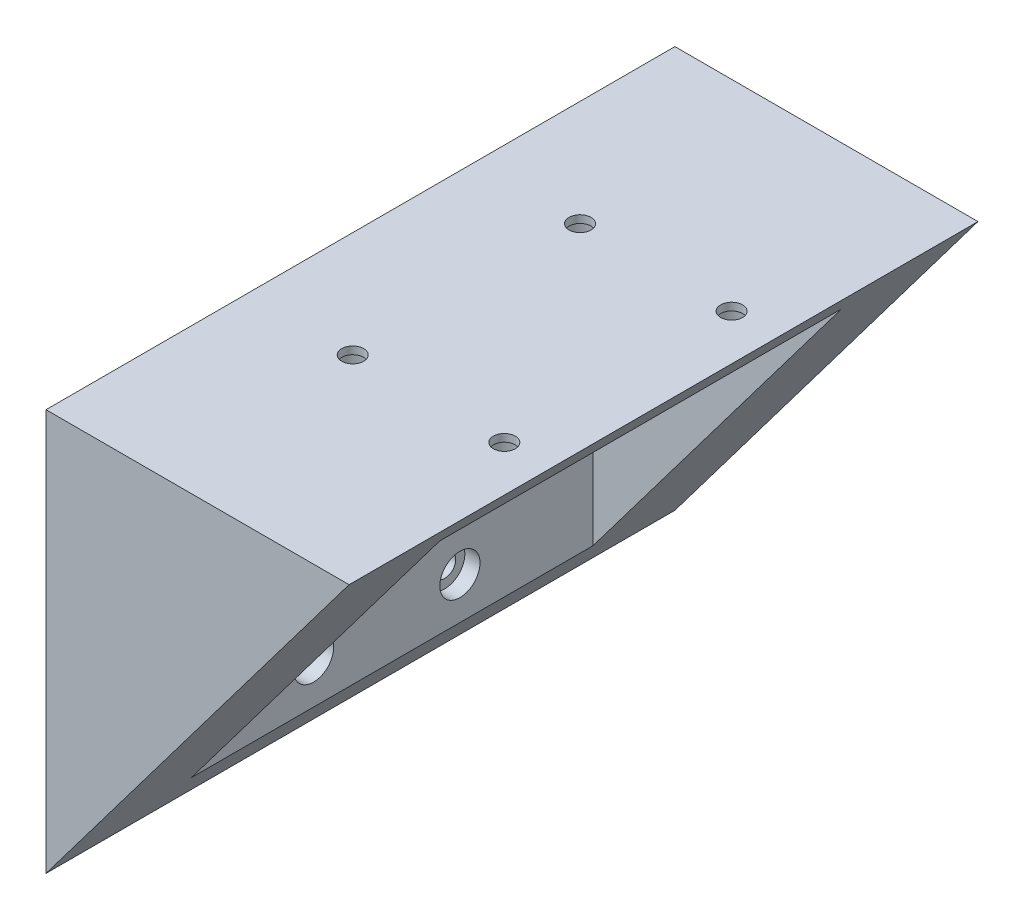
from build123d import *

# Parameters (mm, degrees)
EXTRUDE_1_DEPTH     = 83
CUT_EXTRUDE_1_DEPTH = 26.5
SKETCH_4_R          = 1.45
CUT_EXTRUDE_3_DEPTH = 10
SKETCH_5_R          = 1.45
CUT_EXTRUDE_4_DEPTH = 10
SKETCH_6_R          = 2.8
CUT_EXTRUDE_5_DEPTH = 3
SKETCH_7_R          = 2.65
CUT_EXTRUDE_6_DEPTH = 2


with BuildPart() as part:
    # 草图1 → 凸台-拉伸1 (new body)
    with BuildSketch(Plane.XY):
        Polygon((0, 2.333144796), (0, -50.666855204), (40, 2.333144796), align=None)
    extrude(amount=EXTRUDE_1_DEPTH)

    # 草图3 → 切除-拉伸1 (cut, symmetric)
    with BuildSketch(Plane.XY.offset(41.5)):
        Polygon((36.981132075, -1.666855204), (4.173584906, -1.666855204), (4.173584906, -45.136855204), align=None)
    extrude(amount=CUT_EXTRUDE_1_DEPTH, both=True, mode=Mode.SUBTRACT)

    # 草图4 → 切除-拉伸3 (cut)
    with BuildSketch(Plane(origin=(4.173584906, 0, 0), x_dir=(0, 0, -1), z_dir=(1, 0, 0))):
        with Locations(Location((-32.548580938, -39.636855204, 0), (0, 0, 90))):
            Circle(SKETCH_4_R)
        with Locations(Location((-32.548580938, -28.686855204, 0), (0, 0, 90))):
            Circle(SKETCH_4_R)
        with Locations(Location((-51.86, -28.686855204, 0), (0, 0, 90))):
            Circle(SKETCH_4_R)
        with Locations(Location((-51.86, -39.636855204, 0), (0, 0, 90))):
            Circle(SKETCH_4_R)
    extrude(amount=-CUT_EXTRUDE_3_DEPTH, mode=Mode.SUBTRACT)

    # 草图5 → 切除-拉伸4 (cut)
    with BuildSketch(Plane.XZ.offset(1.666855204)):
        with Locations((13.981132075, 56.5)):
            Circle(SKETCH_5_R)
        with Locations((33.981132075, 56.5)):
            Circle(SKETCH_5_R)
        with Locations((13.981132075, 26.5)):
            Circle(SKETCH_5_R)
        with Locations((33.981132075, 26.5)):
            Circle(SKETCH_5_R)
    extrude(amount=-CUT_EXTRUDE_4_DEPTH, mode=Mode.SUBTRACT)

    # 草图6 → 切除-拉伸5 (cut)
    with BuildSketch(Plane.XZ.offset(1.666855204)):
        with Locations((13.981132075, 56.5)):
            Circle(SKETCH_6_R)
        with Locations((33.981132075, 56.5)):
            Circle(SKETCH_6_R)
        with Locations((13.981132075, 26.5)):
            Circle(SKETCH_6_R)
        with Locations((33.981132075, 26.5)):
            Circle(SKETCH_6_R)
    extrude(amount=-CUT_EXTRUDE_5_DEPTH, mode=Mode.SUBTRACT)

    # 草图7 → 切除-拉伸6 (cut)
    with BuildSketch(Plane(origin=(4.173584906, 0, 0), x_dir=(0, 0, -1), z_dir=(1, 0, 0))):
        with Locations(Location((-51.86, -28.686855204, 0), (0, 0, 90))):
            Circle(SKETCH_7_R)
        with Locations(Location((-32.548580938, -28.686855204, 0), (0, 0, 90))):
            Circle(SKETCH_7_R)
        with Locations(Location((-51.86, -39.636855204, 0), (0, 0, 90))):
            Circle(SKETCH_7_R)
        with Locations(Location((-32.548580938, -39.636855204, 0), (0, 0, 90))):
            Circle(SKETCH_7_R)
    extrude(amount=-CUT_EXTRUDE_6_DEPTH, mode=Mode.SUBTRACT)


solid = part.part
